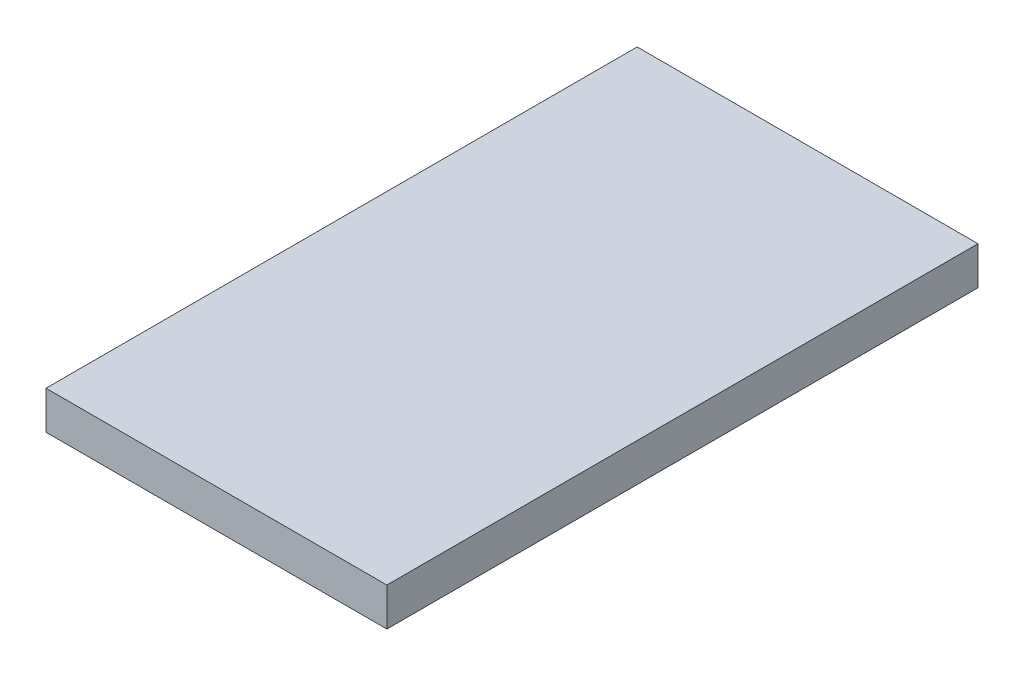
from build123d import *

# Parameters (mm, degrees)
SKETCH_1_W      = 14.3
SKETCH_1_H      = 24.8
EXTRUDE_1_DEPTH = 1.6


with BuildPart() as part:
    # 草图1 → 凸台-拉伸1 (new body)
    with BuildSketch(Plane(origin=(0, 0, 0), x_dir=(1, 0, 0), z_dir=(0, 1, 0))):
        Rectangle(SKETCH_1_W, SKETCH_1_H)
    extrude(amount=EXTRUDE_1_DEPTH)


solid = part.part
